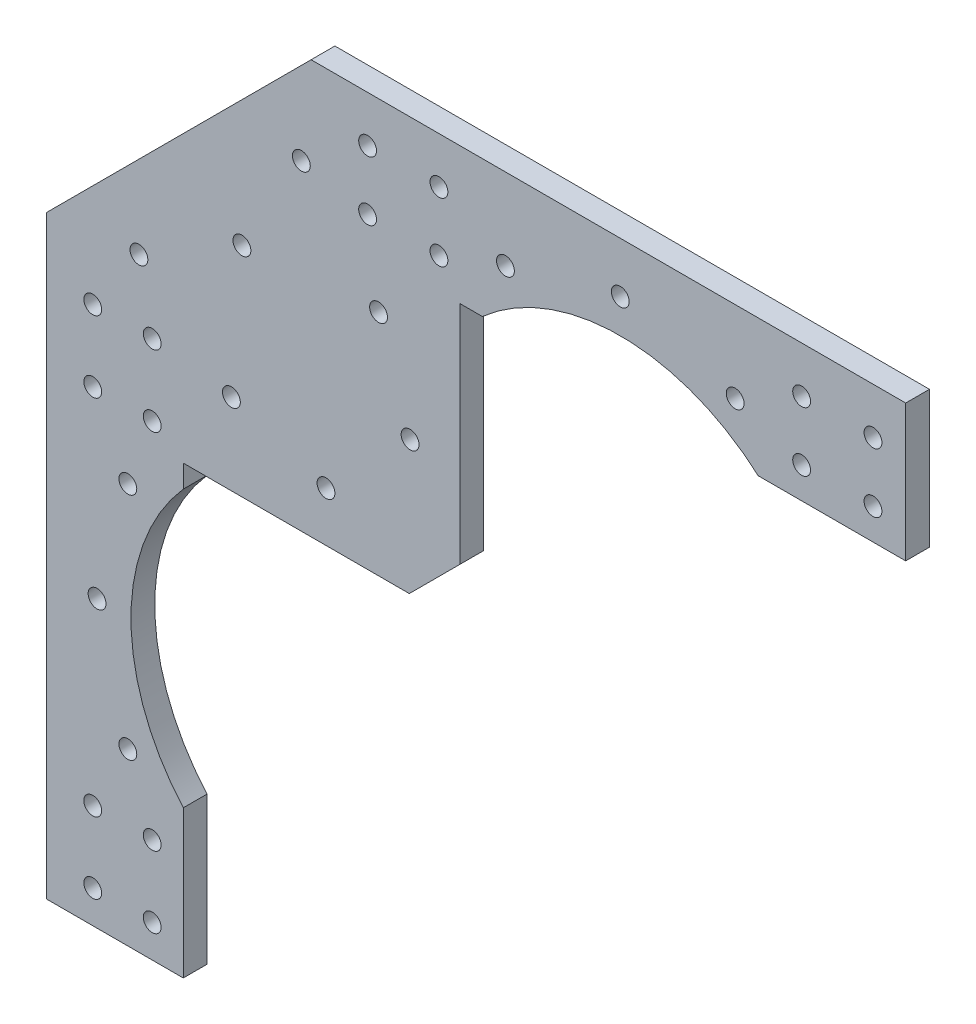
from build123d import *

# Parameters (mm, degrees)
BOSS_EXTRUDE1_DEPTH = 4
SKETCH3_R           = 1.5
CUT_EXTRUDE1_DEPTH  = 10
SKETCH4_R           = 1.5
CUT_EXTRUDE2_DEPTH  = 137.530216436


with BuildPart() as part:
    # Sketch1 → Boss-Extrude1 (new body)
    with BuildSketch(Plane.XY):
        with BuildLine():
            Line((-96.5, -48), (-73.5, -48))
            Line((-73.5, -48), (-73.5, -23.206895527))
            ThreePointArc((-73.5, -23.206895527), (-82.3, 0), (-73.5, 23.206895527))
            Line((-73.5, 23.206895527), (-73.5, 27))
            Line((-73.5, 27), (-35.485281374, 27))
            Line((-35.485281374, 27), (-27, 35.485281374))
            Line((-27, 35.485281374), (-27, 73.5))
            Line((-27, 73.5), (-23.206895527, 73.5))
            ThreePointArc((-23.206895527, 73.5), (0, 82.3), (23.206895527, 73.5))
            Line((23.206895527, 73.5), (48, 73.5))
            Line((48, 73.5), (48, 96.5))
            Line((48, 96.5), (-52, 96.5))
            Line((-52, 96.5), (-96.5, 52))
            Line((-96.5, 52), (-96.5, -48))
        make_face()
    extrude(amount=BOSS_EXTRUDE1_DEPTH)

    # Sketch3 → Cut-Extrude1 (cut)
    with BuildSketch(Plane.XY.offset(4)):
        with Locations((30.5, 78.72592343)):
            Circle(SKETCH3_R)
        with Locations((30.5, 88.72592343)):
            Circle(SKETCH3_R)
        with Locations((42.5, 88.72592343)):
            Circle(SKETCH3_R)
        with Locations((42.5, 78.72592343)):
            Circle(SKETCH3_R)
        with Locations((-42.5, 78.72592343)):
            Circle(SKETCH3_R)
        with Locations((-42.5, 88.72592343)):
            Circle(SKETCH3_R)
        with Locations((-30.5, 88.72592343)):
            Circle(SKETCH3_R)
        with Locations((-30.5, 78.72592343)):
            Circle(SKETCH3_R)
        with Locations((-88.72592343, 30.5)):
            Circle(SKETCH3_R)
        with Locations((-88.72592343, 42.5)):
            Circle(SKETCH3_R)
        with Locations((-78.72592343, 42.5)):
            Circle(SKETCH3_R)
        with Locations((-78.72592343, 30.5)):
            Circle(SKETCH3_R)
        with Locations((-88.72592343, -42.5)):
            Circle(SKETCH3_R)
        with Locations((-88.72592343, -30.5)):
            Circle(SKETCH3_R)
        with Locations((-78.72592343, -30.5)):
            Circle(SKETCH3_R)
        with Locations((-78.72592343, -42.5)):
            Circle(SKETCH3_R)
    extrude(amount=-CUT_EXTRUDE1_DEPTH, mode=Mode.SUBTRACT)

    # Sketch4 → Cut-Extrude2 (cut, through all)
    with BuildSketch(Plane.XY.offset(4)):
        with Locations((-88, 0)):
            Circle(SKETCH4_R)
        with Locations((-63.639610307, 63.639610307)):
            Circle(SKETCH4_R)
        with Locations((0, 88)):
            Circle(SKETCH4_R)
        with Locations((-80.960118382, 53.639610307)):
            Circle(SKETCH4_R)
        with Locations((-53.639610307, 80.960118382)):
            Circle(SKETCH4_R)
        with Locations((19.318516526, 82.823619098)):
            Circle(SKETCH4_R)
        with Locations((-19.318516526, 82.823619098)):
            Circle(SKETCH4_R)
        with Locations((-82.823619098, 19.318516526)):
            Circle(SKETCH4_R)
        with Locations((-82.823619098, -19.318516526)):
            Circle(SKETCH4_R)
        with Locations((-40.658639918, 65.40737726)):
            Circle(SKETCH4_R)
        with Locations((-65.40737726, 40.658639918)):
            Circle(SKETCH4_R)
        with Locations((-49.497474683, 35.355339059)):
            Circle(SKETCH4_R)
        with Locations((-35.355339059, 49.497474683)):
            Circle(SKETCH4_R)
    extrude(amount=-CUT_EXTRUDE2_DEPTH, mode=Mode.SUBTRACT)


solid = part.part
